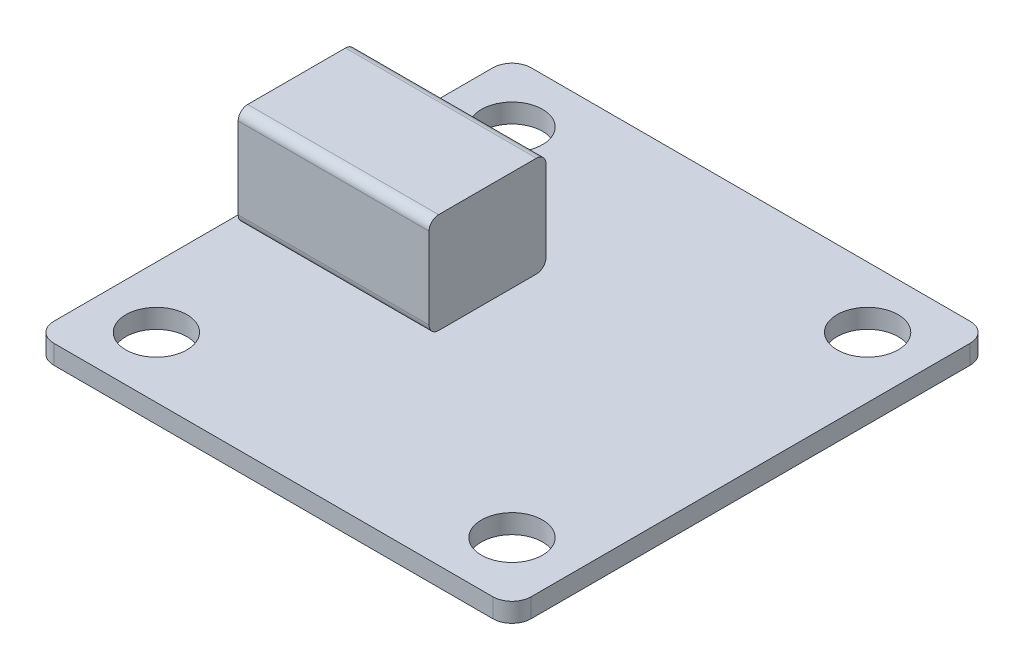
from build123d import *

# Parameters (mm, degrees)
SKETCH_2_W                        = 25
SKETCH_2_H                        = 25
SKETCH_2_R                        = 1.6
EXTRUDE_1_DEPTH                   = 1
FILLET_1_R                        = 1
EXTRUDE_START                     = -0.5
EXTRUDE_2_DEPTH                   = 10
HOLE_WIZARD_3_5_3_5_1_D           = 3.5
HOLE_WIZARD_3_5_3_5_1_DEPTH       = 6
HOLE_WIZARD_3_5_3_5_1_CSINK_D     = 3.55
HOLE_WIZARD_3_5_3_5_1_CSINK_ANGLE = 90
HOLE_WIZARD_3_5_3_5_1_TIP         = 1.051506083


with BuildPart() as part:
    # 스케치2 → 보스-돌출1 (new body)
    with BuildSketch(Plane(origin=(0, 0, 0), x_dir=(1, 0, 0), z_dir=(0, 1, 0))):
        with Locations((-28.42313588, -14.815)):
            Rectangle(SKETCH_2_W, SKETCH_2_H)
        with Locations(Location((-19.11, -24.13, 0), (0, 0, 270))):
            Circle(SKETCH_2_R, mode=Mode.SUBTRACT)
        with Locations(Location((-37.73627176, -24.13, 0), (0, 0, 270))):
            Circle(SKETCH_2_R, mode=Mode.SUBTRACT)
        with Locations(Location((-37.73627176, -5.5, 0), (0, 0, 270))):
            Circle(SKETCH_2_R, mode=Mode.SUBTRACT)
        with Locations(Location((-19.11, -5.5, 0), (0, 0, 270))):
            Circle(SKETCH_2_R, mode=Mode.SUBTRACT)
    extrude(amount=EXTRUDE_1_DEPTH)

    # 필렛1
    fillet_1_edges = [part.edges().sort_by_distance(p)[0] for p in [
        (-15.92313588, 0.5, 27.315),
        (-40.92313588, 0.5, 27.315),
        (-40.92313588, 0.5, 2.315),
        (-15.92313588, 0.5, 2.315),
    ]]
    fillet(fillet_1_edges, radius=FILLET_1_R)

    # 스케치4 → 보스-돌출2 (add)
    with BuildSketch(Plane.ZY.offset(40.92313588).offset(EXTRUDE_START)):
        with BuildLine():
            Line((11.536225379, 1), (16.659931287, 1))
            ThreePointArc((16.659931287, 1), (17.013484677, 1.146446609), (17.159931287, 1.5))
            Line((17.159931287, 1.5), (17.159931287, 5.75777714))
            ThreePointArc((17.159931287, 5.75777714), (17.013484677, 6.111330531), (16.659931287, 6.25777714))
            Line((16.659931287, 6.25777714), (11.536225379, 6.25777714))
            ThreePointArc((11.536225379, 6.25777714), (11.182671988, 6.111330531), (11.036225379, 5.75777714))
            Line((11.036225379, 5.75777714), (11.036225379, 1.5))
            ThreePointArc((11.036225379, 1.5), (11.182671988, 1.146446609), (11.536225379, 1))
        make_face()
    extrude(amount=-EXTRUDE_2_DEPTH)

    # Ø3.5 (3.5) 지름 구멍1
    with Locations(Plane.ZY.offset(40.42313588)):
        with Locations((14.083142465, 3.599368414)):
            CounterSinkHole(HOLE_WIZARD_3_5_3_5_1_D / 2, HOLE_WIZARD_3_5_3_5_1_CSINK_D / 2, depth=HOLE_WIZARD_3_5_3_5_1_DEPTH, counter_sink_angle=HOLE_WIZARD_3_5_3_5_1_CSINK_ANGLE)
            with Locations((0, 0, -(HOLE_WIZARD_3_5_3_5_1_DEPTH + HOLE_WIZARD_3_5_3_5_1_TIP / 2))):  # 118° drill point
                Cone(0, HOLE_WIZARD_3_5_3_5_1_D / 2, HOLE_WIZARD_3_5_3_5_1_TIP, mode=Mode.SUBTRACT)


solid = part.part
